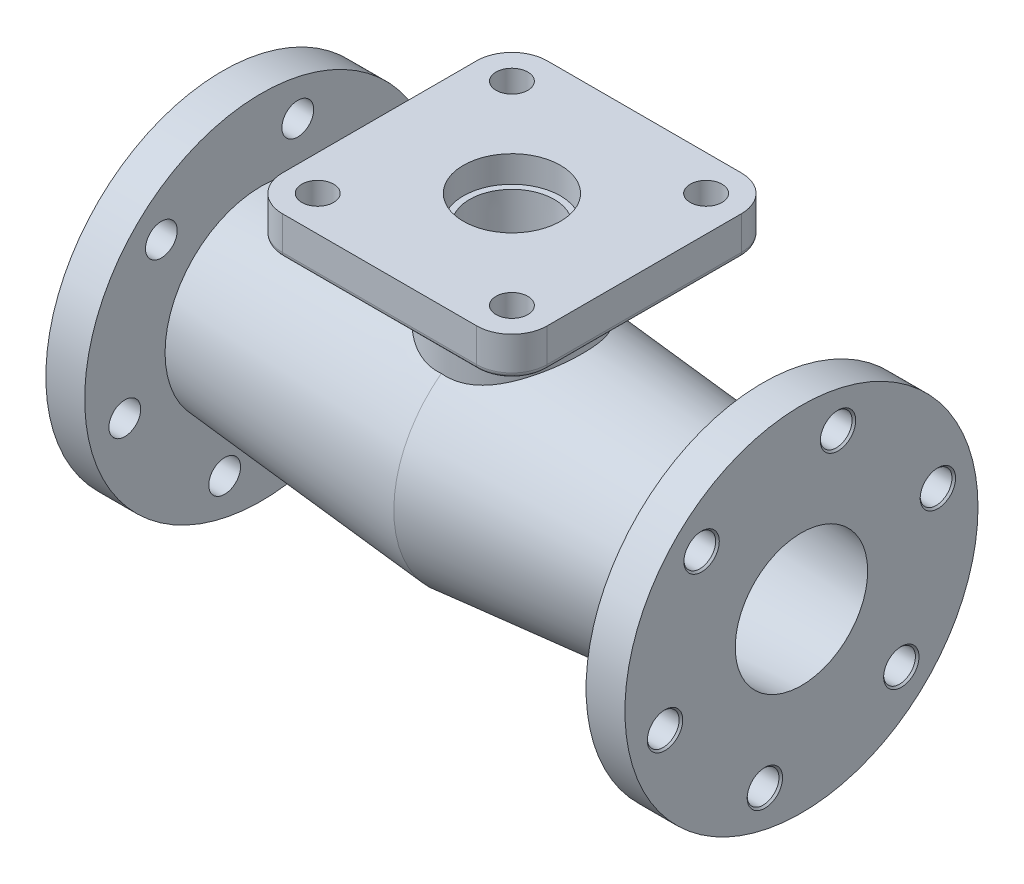
from build123d import *

# Parameters (mm, degrees)
SKETCH6_R                        = 40
SKETCH6_R_2                      = 9
BOSS_EXTRUDE2_DEPTH              = 22
BOSS_EXTRUDE3_REACH              = 295.564
SKETCH6_2_R                      = 40
FILLET1_R                        = 3
F_20_0MM_DOWEL_HOLE2_D           = 18
F_20_0MM_DOWEL_HOLE2_DEPTH       = 22
F_20_0MM_DOWEL_HOLE2_CSINK_D     = 20.05
F_20_0MM_DOWEL_HOLE2_CSINK_ANGLE = 90
CIRPATTERN5_COUNT                = 6
MIRROR1_COPY_1_D                 = 18
MIRROR1_COPY_1_DEPTH             = 22
MIRROR1_COPY_1_CSINK_D           = 20.05
MIRROR1_COPY_1_CSINK_ANGLE       = 90
MIRROR1_COPY_2_D                 = 18
MIRROR1_COPY_2_DEPTH             = 22
MIRROR1_COPY_2_CSINK_D           = 20.05
MIRROR1_COPY_2_CSINK_ANGLE       = 90
MIRROR1_COPY_3_D                 = 18
MIRROR1_COPY_3_DEPTH             = 22
MIRROR1_COPY_3_CSINK_D           = 20.05
MIRROR1_COPY_3_CSINK_ANGLE       = 90
MIRROR1_COPY_4_D                 = 18
MIRROR1_COPY_4_DEPTH             = 22
MIRROR1_COPY_4_CSINK_D           = 20.05
MIRROR1_COPY_4_CSINK_ANGLE       = 90
MIRROR1_COPY_5_D                 = 18
MIRROR1_COPY_5_DEPTH             = 22
MIRROR1_COPY_5_CSINK_D           = 20.05
MIRROR1_COPY_5_CSINK_ANGLE       = 90


with BuildPart() as part:
    # Sketch1 → Revolve1 (revolve)
    with BuildSketch(Plane.XY, mode=Mode.PRIVATE) as revolve1_sk:
        Polygon((0, -51.848140818), (-164, -37.5), (-164, -100), (-142, -100), (-142, -54.482048161), (0, -66.905438381), (142, -54.482048161), (142, -100), (164, -100), (164, -37.5), align=None)
    revolve(revolve1_sk.sketch.rotate(Axis((0, 0, 0), (-1, 0, 0)), 270), axis=Axis((0, 0, 0), (-1, 0, 0)))

    # Sketch6<2> → Boss-Extrude3 (add, up to next)
    with BuildSketch(Plane(origin=(0, 122, 0), x_dir=(1, 0, 0), z_dir=(0, 1, 0)), mode=Mode.PRIVATE) as boss_extrude3_sk1:
        with Locations(Location((0, 0, 0), (0, 0, 90))):
            Circle(SKETCH6_2_R)
    boss_extrude3_tool1 = extrude(boss_extrude3_sk1.sketch, amount=-BOSS_EXTRUDE3_REACH, mode=Mode.PRIVATE) - part.part


with BuildPart() as body_2:
    # Sketch6 → Boss-Extrude2 (new body)
    with BuildSketch(Plane(origin=(0, 122, 0), x_dir=(1, 0, 0), z_dir=(0, 1, 0))):
        with BuildLine():
            Line((-55, 75), (55, 75))
            ThreePointArc((55, 75), (69.142135624, 69.142135624), (75, 55))
            Line((75, 55), (75, -55))
            ThreePointArc((75, -55), (69.142135624, -69.142135624), (55, -75))
            Line((55, -75), (-55, -75))
            ThreePointArc((-55, -75), (-69.142135624, -69.142135624), (-75, -55))
            Line((-75, -55), (-75, 55))
            ThreePointArc((-75, 55), (-69.142135624, 69.142135624), (-55, 75))
        make_face()
        with Locations(Location((0, 0, 0), (0, 0, 270))):
            Circle(SKETCH6_R, mode=Mode.SUBTRACT)
        with Locations(Location((-55, 55, 0), (0, 0, 270))):
            Circle(SKETCH6_R_2, mode=Mode.SUBTRACT)
        with Locations(Location((-55, -55, 0), (0, 0, 270))):
            Circle(SKETCH6_R_2, mode=Mode.SUBTRACT)
        with Locations(Location((55, -55, 0), (0, 0, 270))):
            Circle(SKETCH6_R_2, mode=Mode.SUBTRACT)
        with Locations(Location((55, 55, 0), (0, 0, 270))):
            Circle(SKETCH6_R_2, mode=Mode.SUBTRACT)
    extrude(amount=-BOSS_EXTRUDE2_DEPTH)


with BuildPart() as part_1:
    add(part.part)

    add(body_2.part)  # Boss-Extrude3 merges body 2
    add(boss_extrude3_tool1.solids().sort_by_distance((0, 122, 0))[0])

    # Sketch8 → Cut-Revolve1 (revolve, cut)
    with BuildSketch(Plane.XY, mode=Mode.PRIVATE) as cut_revolve1_sk:
        Polygon((0, 122), (0, 51.219037993), (23.026339686, 51.219037993), (24, 107), (27.5, 107), (27.5, 122), align=None)
    revolve(cut_revolve1_sk.sketch.rotate(Axis((0, -127.507832113, 0), (0, 1, 0)), 90), axis=Axis((0, -127.507832113, 0), (0, 1, 0)), mode=Mode.SUBTRACT)

    # Fillet1
    fillet1_edges = [part_1.edges().sort_by_distance(p)[0] for p in [
        (69.142135624, 100, -69.142135624),
        (75, 100, 0),
        (69.142135624, 100, 69.142135624),
        (0, 100, 75),
        (-69.142135624, 100, 69.142135624),
        (-75, 100, 0),
        (-69.142135624, 100, -69.142135624),
        (0, 100, -75),
    ]]
    fillet(fillet1_edges, radius=FILLET1_R)

    # Ø20.0mm Dowel Hole2
    with Locations(Plane(origin=(164, 0, 0), x_dir=(0, 0, -1), z_dir=(1, 0, 0))):
        with Locations((-77.274066103, -20.705523608)):
            f_20_0mm_dowel_hole2 = CounterSinkHole(F_20_0MM_DOWEL_HOLE2_D / 2, F_20_0MM_DOWEL_HOLE2_CSINK_D / 2, depth=F_20_0MM_DOWEL_HOLE2_DEPTH, counter_sink_angle=F_20_0MM_DOWEL_HOLE2_CSINK_ANGLE)

    # CirPattern5: Ø20.0mm Dowel Hole2 ×6 about axis
    cirpattern5_axis = Axis((0, 0, 0), (1, 0, 0))
    for i in range(1, CIRPATTERN5_COUNT):
        add(f_20_0mm_dowel_hole2.rotate(cirpattern5_axis, i * 360 / CIRPATTERN5_COUNT), mode=Mode.SUBTRACT)

    # Mirror1: Ø20.0mm Dowel Hole2 across plane
    add(f_20_0mm_dowel_hole2.mirror(Plane(origin=(0, 0, 0), x_dir=(0, 0, 1), z_dir=(1, 0, 0))), mode=Mode.SUBTRACT)

    # Mirror1 copy 1
    with Locations(Plane(origin=(-164, 0, 0), x_dir=(0, 0.8660254037844386, -0.5000000000000001), z_dir=(-1, 0, 0))):
        with Locations((-77.274066103, 20.705523608)):
            CounterSinkHole(MIRROR1_COPY_1_D / 2, MIRROR1_COPY_1_CSINK_D / 2, depth=MIRROR1_COPY_1_DEPTH, counter_sink_angle=MIRROR1_COPY_1_CSINK_ANGLE)

    # Mirror1 copy 2
    with Locations(Plane(origin=(-164, 0, 0), x_dir=(0, 0.8660254037844387, 0.4999999999999998), z_dir=(-1, 0, 0))):
        with Locations((-77.274066103, 20.705523608)):
            CounterSinkHole(MIRROR1_COPY_2_D / 2, MIRROR1_COPY_2_CSINK_D / 2, depth=MIRROR1_COPY_2_DEPTH, counter_sink_angle=MIRROR1_COPY_2_CSINK_ANGLE)

    # Mirror1 copy 3
    with Locations(Plane.ZY.offset(164)):
        with Locations((-77.274066103, 20.705523608)):
            CounterSinkHole(MIRROR1_COPY_3_D / 2, MIRROR1_COPY_3_CSINK_D / 2, depth=MIRROR1_COPY_3_DEPTH, counter_sink_angle=MIRROR1_COPY_3_CSINK_ANGLE)

    # Mirror1 copy 4
    with Locations(Plane(origin=(-164, 0, 0), x_dir=(0, -0.8660254037844384, 0.5000000000000004), z_dir=(-1, 0, 0))):
        with Locations((-77.274066103, 20.705523608)):
            CounterSinkHole(MIRROR1_COPY_4_D / 2, MIRROR1_COPY_4_CSINK_D / 2, depth=MIRROR1_COPY_4_DEPTH, counter_sink_angle=MIRROR1_COPY_4_CSINK_ANGLE)

    # Mirror1 copy 5
    with Locations(Plane(origin=(-164, 0, 0), x_dir=(0, -0.8660254037844386, -0.5000000000000001), z_dir=(-1, 0, 0))):
        with Locations((-77.274066103, 20.705523608)):
            CounterSinkHole(MIRROR1_COPY_5_D / 2, MIRROR1_COPY_5_CSINK_D / 2, depth=MIRROR1_COPY_5_DEPTH, counter_sink_angle=MIRROR1_COPY_5_CSINK_ANGLE)


solid = part_1.part
